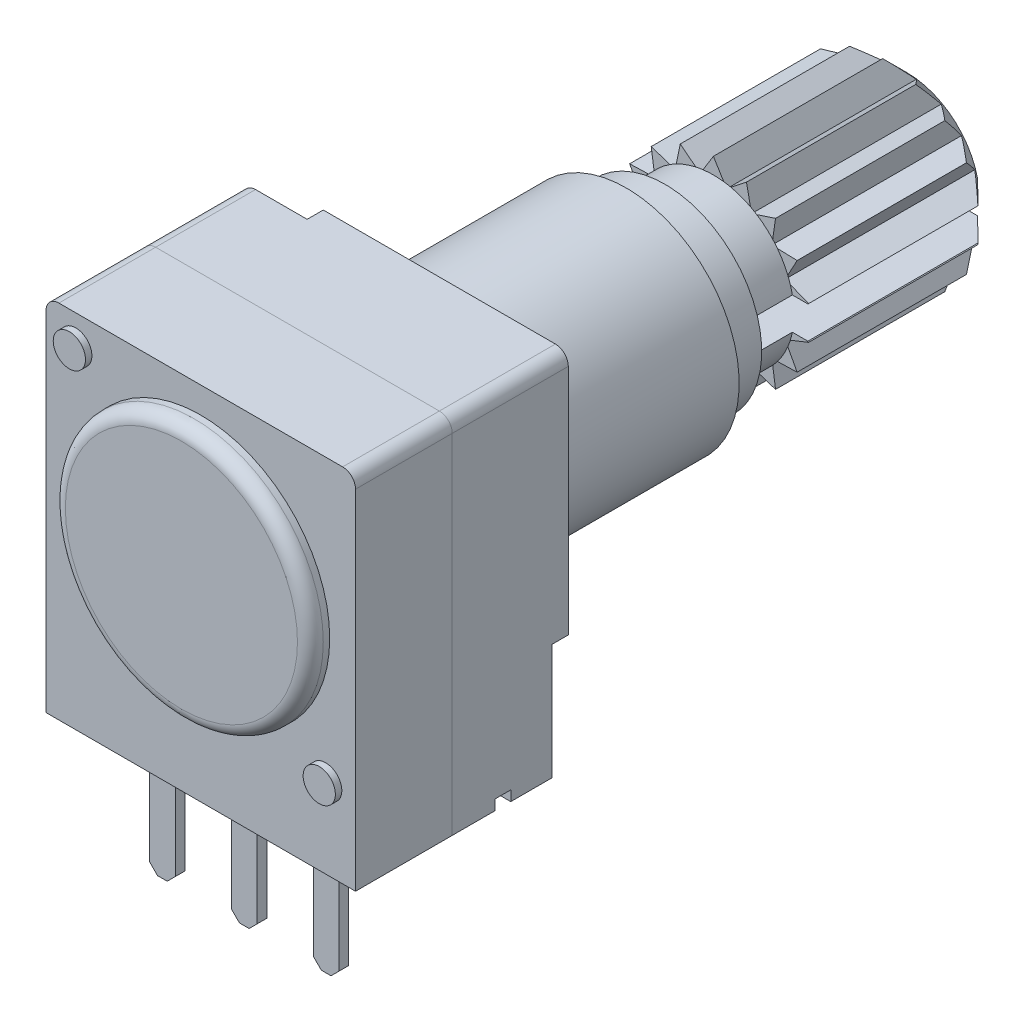
from build123d import *

# Parameters (mm, degrees)
SKETCH1_W                      = 9.6
SKETCH1_H                      = 11.2
UPPER_BODY_EXTRUDE_DEPTH       = 3.6
SKETCH13_W                     = 9.6
SKETCH13_H                     = 11.2
LOWER_BODY_EXTRUDE_DEPTH       = 3
SKETCH2_R                      = 4
BOTTOM_DOME_EXTRUDE_DEPTH      = 0.6
DOME_FILLET_R                  = 0.4
SKETCH3_R                      = 3.5
THREADED_SECTION_EXTRUDE_DEPTH = 6.6
SKETCH4_R                      = 3
STRAIN_RELIEF_EXTRUDE_DEPTH    = 1.2
SKETCH10_R                     = 2.5
ACTUATOR_SHAFT_EXTRUDE_DEPTH   = 1.5
SKETCH11_R                     = 3
SLINED_SECTION_EXTRUDE_DEPTH   = 6
SHAFT_END_CHAMFER_SIZE         = 0.75
SKETCH5_R                      = 3.244987866
SPLINE_CUT_DEPTH               = 6
SHAFT_SLOT_XUT_REACH           = 28.904
SKETCH12_W                     = 6.542928606
SKETCH12_H                     = 1
SKETCH14_W                     = 0.8
SKETCH14_H                     = 0.3
PIN_EXTRUDE_DEPTH              = 4
PIN_TIP_FILLET_SIZE            = 0.25
UPPER_BODY_EDGE_FILLET_R       = 0.4
LOWER_BODY_EDGE_FILLET_R       = 0.4
SKETCH15_W                     = 0.496561546
SKETCH15_H                     = 0.496561546
MOUNTING_FACE_SLOT_CUT_DEPTH   = 22.252999788
SKETCH17_W                     = 2
SKETCH17_H                     = 0.6
LOCATING_PIN_EXTRUDE_DEPTH     = 1
LOCATING_PIN_CHAMFER_SIZE      = 0.1
BODY_RIVET_RECESS_CUT_DEPTH    = 0.5
RIVET_EXTRUDE_DEPTH            = 0.3
RIVET_EXTRUDE_DEPTH_BACK       = 6.3
SKETCH18_R                     = 0.5
RIVET_EXTRUDE_2_DEPTH          = 0.3
RIVET_EXTRUDE_2_DEPTH_BACK     = 6.3
SKETCH22_R                     = 0.427200187
ALIGNMENT_CENTRE_PIN_CUT_DEPTH = 0.2


with BuildPart() as part:
    # Sketch1 → Upper Body Extrude (new body)
    with BuildSketch(Plane.XY):
        with Locations((4.8, 5.6)):
            Rectangle(SKETCH1_W, SKETCH1_H)
    extrude(amount=UPPER_BODY_EXTRUDE_DEPTH)

    # Sketch3 → Threaded Section Extrude (add)
    with BuildSketch(Plane(origin=(0, 0, 0), x_dir=(-1, 0, 0), z_dir=(0, 0, -1))):
        with Locations((-4.8, 6.392421353)):
            Circle(SKETCH3_R)
    extrude(amount=THREADED_SECTION_EXTRUDE_DEPTH)

    # Sketch4 → Strain Relief Extrude (add)
    with BuildSketch(Plane(origin=(0, 0, -6.6), x_dir=(-1, 0, 0), z_dir=(0, 0, -1))):
        with Locations((-4.8, 6.392421353)):
            Circle(SKETCH4_R)
    extrude(amount=STRAIN_RELIEF_EXTRUDE_DEPTH)

    # Sketch10 → Actuator Shaft Extrude (add)
    with BuildSketch(Plane(origin=(0, 0, -7.8), x_dir=(-1, 0, 0), z_dir=(0, 0, -1))):
        with Locations((-4.8, 6.392421353)):
            Circle(SKETCH10_R)
    extrude(amount=ACTUATOR_SHAFT_EXTRUDE_DEPTH)

    # Sketch11 → Slined Section Extrude (add)
    with BuildSketch(Plane(origin=(0, 0, -9.3), x_dir=(-1, 0, 0), z_dir=(0, 0, -1))):
        with Locations((-4.8, 6.392421353)):
            Circle(SKETCH11_R)
    extrude(amount=SLINED_SECTION_EXTRUDE_DEPTH)

    # Shaft End Chamfer
    shaft_end_chamfer_edges = [part.edges().sort_by_distance(p)[0] for p in [
        (7.8, 6.392421353, -15.3),
    ]]
    chamfer(shaft_end_chamfer_edges, length=SHAFT_END_CHAMFER_SIZE)

    # Sketch5 → Spline CUt (cut)
    with BuildSketch(Plane(origin=(0, 0, -15.3), x_dir=(-1, 0, 0), z_dir=(0, 0, -1))):
        with Locations((-4.8, 6.392421353)):
            Circle(SKETCH5_R)
        Polygon((-4.8, 9.392421353), (-5.211446902, 8.72585269), (-5.82606043, 9.211499216), (-5.984714138, 8.444406433), (-6.728362829, 8.690554683), (-6.615087364, 7.915460491), (-7.398076211, 7.892421353), (-7.026534266, 7.202813552), (-7.754423259, 6.913365886), (-7.169428276, 6.392421353), (-7.754423259, 5.87147682), (-7.026534266, 5.582029155), (-7.398076211, 4.892421353), (-6.615087364, 4.869382215), (-6.728362829, 4.094288024), (-5.984714138, 4.340436274), (-5.82606043, 3.573343491), (-5.211446902, 4.058990017), (-4.8, 3.392421353), (-4.388553098, 4.058990017), (-3.77393957, 3.573343491), (-3.615285862, 4.340436274), (-2.871637171, 4.094288024), (-2.984912636, 4.869382215), (-2.201923789, 4.892421353), (-2.573465734, 5.582029155), (-1.845576741, 5.87147682), (-2.430571724, 6.392421353), (-1.845576741, 6.913365886), (-2.573465734, 7.202813552), (-2.201923789, 7.892421353), (-2.984912636, 7.915460491), (-2.871637171, 8.690554683), (-3.615285862, 8.444406433), (-3.77393957, 9.211499216), (-4.388553098, 8.72585269), align=None, mode=Mode.SUBTRACT)
    extrude(amount=-SPLINE_CUT_DEPTH, mode=Mode.SUBTRACT)

    # Shaft Slot Xut: up to this face of the body (flat: up to its plane)
    shaft_slot_xut_end = Plane(part.part.faces().sort_by_distance((7.715147186, 6.392421353, -7.8))[0])
    # Sketch12 → Shaft Slot Xut (cut, up to the picked face)
    with BuildSketch(Plane(origin=(0, 0, -15.3), x_dir=(-1, 0, 0), z_dir=(0, 0, -1)), mode=Mode.PRIVATE) as shaft_slot_xut_sk1:
        with Locations((-4.778190238, 6.392421353)):
            Rectangle(SKETCH12_W, SKETCH12_H)
    shaft_slot_xut_tool1 = split(extrude(shaft_slot_xut_sk1.sketch, amount=-SHAFT_SLOT_XUT_REACH, mode=Mode.PRIVATE), bisect_by=shaft_slot_xut_end, keep=Keep.BOTH, mode=Mode.PRIVATE)
    add(shaft_slot_xut_tool1.solids().sort_by(Axis((4.77819, 6.392421, -15.3), (0, 0, 1)))[0], mode=Mode.SUBTRACT)

    # Upper Body Edge Fillet
    upper_body_edge_fillet_edges = [part.edges().sort_by_distance(p)[0] for p in [
        (0, 11.2, 1.8),
        (9.6, 11.2, 1.8),
    ]]
    fillet(upper_body_edge_fillet_edges, radius=UPPER_BODY_EDGE_FILLET_R)

    # Sketch15 → Mounting Face Slot Cut (cut, through all)
    with BuildSketch(Plane.ZY):
        with Locations((2.032878938, 0.06764173)):
            Rectangle(SKETCH15_W, SKETCH15_H)
    extrude(amount=-MOUNTING_FACE_SLOT_CUT_DEPTH, mode=Mode.SUBTRACT)

    # Sketch17 → Locating Pin Extrude (add)
    with BuildSketch(Plane(origin=(0, 0, 0), x_dir=(-1, 0, 0), z_dir=(0, 0, -1))):
        with Locations((-4.8, 0.3)):
            Rectangle(SKETCH17_W, SKETCH17_H)
    extrude(amount=LOCATING_PIN_EXTRUDE_DEPTH)

    # Locating Pin Chamfer
    locating_pin_chamfer_edges = [part.edges().sort_by_distance(p)[0] for p in [
        (5.8, 0.3, -1),
        (4.8, 0, -1),
        (3.8, 0.3, -1),
        (4.8, 0.6, -1),
    ]]
    chamfer(locating_pin_chamfer_edges, length=LOCATING_PIN_CHAMFER_SIZE)

    # Sketch20 → Body Rivet Recess Cut (cut)
    with BuildSketch(Plane(origin=(0, 0, 0), x_dir=(-1, 0, 0), z_dir=(0, 0, -1))):
        with BuildLine():
            Line((-2, 11.2), (-2, 9.95))
            ThreePointArc((-2, 9.95), (-1.780330086, 9.419669914), (-1.25, 9.2))
            Line((-1.25, 9.2), (0, 9.2))
            Line((0, 9.2), (0, 11.2))
            Line((0, 11.2), (-2, 11.2))
        make_face()
        with BuildLine():
            Line((-7.6, 1.584842707), (-7.6, 2.834842707))
            ThreePointArc((-7.6, 2.834842707), (-7.819669914, 3.365172793), (-8.35, 3.584842707))
            Line((-8.35, 3.584842707), (-9.6, 3.584842707))
            Line((-9.6, 3.584842707), (-9.6, 0))
            Line((-9.6, 0), (-7.6, 0))
            Line((-7.6, 0), (-7.6, 1.584842707))
        make_face()
    extrude(amount=-BODY_RIVET_RECESS_CUT_DEPTH, mode=Mode.SUBTRACT)


with BuildPart() as body_2:
    # Sketch13 → Lower Body Extrude (new body)
    with BuildSketch(Plane.XY.offset(3.6)):
        with Locations((4.8, 5.6)):
            Rectangle(SKETCH13_W, SKETCH13_H)
    extrude(amount=LOWER_BODY_EXTRUDE_DEPTH)

    # Sketch14 → Pin Extrude (add)
    with BuildSketch(Plane.XZ):
        with Locations((4.8, 5.1)):
            Rectangle(SKETCH14_W, SKETCH14_H)
        with Locations((7.34, 5.1)):
            Rectangle(SKETCH14_W, SKETCH14_H)
        with Locations((2.26, 5.1)):
            Rectangle(SKETCH14_W, SKETCH14_H)
    extrude(amount=PIN_EXTRUDE_DEPTH)

    # Pin Tip FIllet
    pin_tip_fillet_edges = [body_2.edges().sort_by_distance(p)[0] for p in [
        (4.4, -4, 5.1),
        (5.2, -4, 5.1),
        (7.74, -4, 5.1),
        (6.94, -4, 5.1),
        (2.66, -4, 5.1),
        (1.86, -4, 5.1),
    ]]
    chamfer(pin_tip_fillet_edges, length=PIN_TIP_FILLET_SIZE)

    # Lower Body Edge Fillet
    lower_body_edge_fillet_edges = [body_2.edges().sort_by_distance(p)[0] for p in [
        (0, 11.2, 5.1),
        (9.6, 11.2, 5.1),
    ]]
    fillet(lower_body_edge_fillet_edges, radius=LOWER_BODY_EDGE_FILLET_R)

    # Sketch22 → Alignment Centre-Pin Cut (cut)
    with BuildSketch(Plane.XZ):
        with Locations(Location((4.8, 5.1, 0), (0, 0, 270))):
            Circle(SKETCH22_R)
    extrude(amount=-ALIGNMENT_CENTRE_PIN_CUT_DEPTH, mode=Mode.SUBTRACT)


with BuildPart() as body_3:
    # Sketch2 → Bottom Dome Extrude (new body)
    with BuildSketch(Plane.XY.offset(6.6)):
        with Locations((4.8, 6.392421353)):
            Circle(SKETCH2_R)
    extrude(amount=BOTTOM_DOME_EXTRUDE_DEPTH)

    # Dome Fillet
    dome_fillet_edges = [body_3.edges().sort_by_distance(p)[0] for p in [
        (0.8, 6.392421353, 7.2),
    ]]
    fillet(dome_fillet_edges, radius=DOME_FILLET_R)


with BuildPart() as body_4:
    # Sketch18 → Rivet Extrude (new, two sides: drawn at the far end of the back side and taken through both)
    with BuildSketch(Plane(origin=(0, 0, 0.5), x_dir=(-1, 0, 0), z_dir=(0, 0, -1)).offset(-RIVET_EXTRUDE_DEPTH_BACK)):
        with Locations((-0.92435637, 10.294906004)):
            Circle(SKETCH18_R)
    extrude(amount=RIVET_EXTRUDE_DEPTH + RIVET_EXTRUDE_DEPTH_BACK)


with BuildPart() as body_5:
    # Sketch18 → Rivet Extrude 2 (new, two sides: drawn at the far end of the back side and taken through both)
    with BuildSketch(Plane(origin=(0, 0, 0.5), x_dir=(-1, 0, 0), z_dir=(0, 0, -1)).offset(-RIVET_EXTRUDE_2_DEPTH_BACK)):
        with Locations((-8.67564363, 2.489936702)):
            Circle(SKETCH18_R)
    extrude(amount=RIVET_EXTRUDE_2_DEPTH + RIVET_EXTRUDE_2_DEPTH_BACK)


with BuildPart() as alignment_centre_pin_cut_piece_1:
    # of the separate pieces the step leaves, piece 1, a body of its own (alignment_centre_pin_cut_pieces)
    add(body_2.part.solids().sort_by_distance((9.6, 10.8, 3.6))[0])


with BuildPart() as alignment_centre_pin_cut_piece_2:
    # of the separate pieces the step leaves, piece 2, a body of its own (alignment_centre_pin_cut_pieces)
    add(body_2.part.solids().sort_by_distance((4.4, -3.75, 4.95))[0])


solid = Compound([part.part, body_3.part, body_4.part, body_5.part, alignment_centre_pin_cut_piece_1.part, alignment_centre_pin_cut_piece_2.part])
